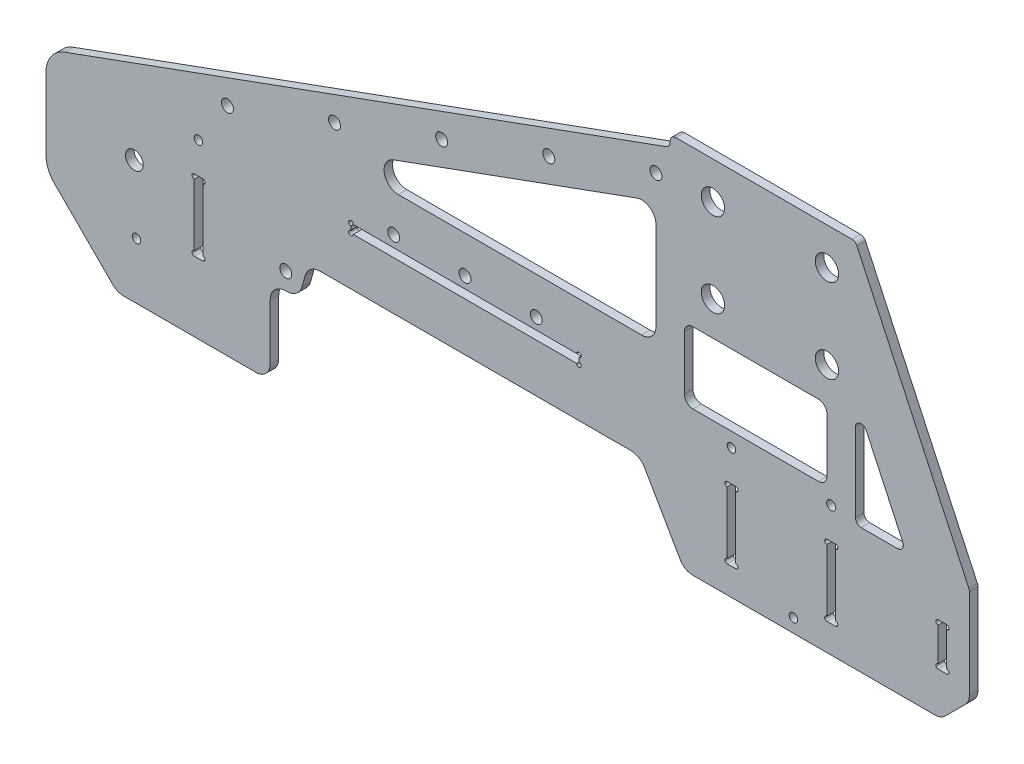
from build123d import *

# Parameters (mm, degrees)
SKETCH1_W           = 274
SKETCH1_H           = 44
BOSS_EXTRUDE1_DEPTH = 3
SKETCH2_W           = 3
SKETCH2_H           = 25
CUT_EXTRUDE1_DEPTH  = 144.923590839
SKETCH3_W           = 274
SKETCH3_H           = 6
BOSS_EXTRUDE2_DEPTH = 3
SKETCH4_W           = 80
SKETCH4_H           = 3
CUT_EXTRUDE2_DEPTH  = 146.869804963
SKETCH6_R           = 2.1
CUT_EXTRUDE3_DEPTH  = 146.869804963
CUT_EXTRUDE4_DEPTH  = 146.869804963
SKETCH8_R           = 1.5
CUT_EXTRUDE5_DEPTH  = 3
BOSS_EXTRUDE4_DEPTH = 3
BOSS_EXTRUDE5_DEPTH = 3
FILLET2_R           = 5
BOSS_EXTRUDE6_DEPTH = 3
FILLET3_R           = 2
SKETCH13_W          = 3
SKETCH13_H          = 15
CUT_EXTRUDE6_DEPTH  = 3
CHAMFER2_SIZE       = 10
FILLET4_R           = 2
FILLET5_R           = 5
CUT_EXTRUDE9_DEPTH  = 220.631509579
FILLET6_R           = 5.5
BOSS_EXTRUDE7_DEPTH = 3
FILLET7_R           = 10
SKETCH18_R          = 4.1
CUT_EXTRUDE10_DEPTH = 220.631509579
SKETCH19_R          = 1.6
SKETCH19_W          = 3
SKETCH19_H          = 25
CUT_EXTRUDE11_DEPTH = 220.631509579
SKETCH20_R          = 3.1
CUT_EXTRUDE12_DEPTH = 220.631509579
SKETCH21_R          = 0.8
CUT_EXTRUDE13_DEPTH = 220.631509579
SKETCH22_R          = 2.1
CUT_EXTRUDE14_DEPTH = 220.631509579
SKETCH23_W          = 50
SKETCH23_H          = 25
CUT_EXTRUDE15_DEPTH = 220.631509579
FILLET8_R           = 3
SKETCH25_R          = 2.1
CUT_EXTRUDE16_DEPTH = 220.631509579


with BuildPart() as part:
    # Sketch1 → Boss-Extrude1 (new body)
    with BuildSketch(Plane.XY):
        with Locations((0, 22)):
            Rectangle(SKETCH1_W, SKETCH1_H)
    extrude(amount=BOSS_EXTRUDE1_DEPTH)

    # Sketch2 → Cut-Extrude1 (cut, through all)
    with BuildSketch(Plane.XY.offset(3)):
        with Locations((-93.5, 22)):
            Rectangle(SKETCH2_W, SKETCH2_H)
        with Locations((93.5, 22)):
            Rectangle(SKETCH2_W, SKETCH2_H)
    extrude(amount=-CUT_EXTRUDE1_DEPTH, mode=Mode.SUBTRACT)

    # Sketch3 → Boss-Extrude2 (add)
    with BuildSketch(Plane.XY.offset(3)):
        with Locations((0, 47)):
            Rectangle(SKETCH3_W, SKETCH3_H)
    extrude(amount=-BOSS_EXTRUDE2_DEPTH)

    # Sketch4 → Cut-Extrude2 (cut, through all)
    with BuildSketch(Plane.XY.offset(3)):
        with Locations((0, 45.5)):
            Rectangle(SKETCH4_W, SKETCH4_H)
    extrude(amount=-CUT_EXTRUDE2_DEPTH, mode=Mode.SUBTRACT)

    # Sketch6 → Cut-Extrude3 (cut, through all)
    with BuildSketch(Plane(origin=(0, 0, 0), x_dir=(-1, 0, 0), z_dir=(0, 0, -1))):
        with Locations((62.874847501, 21)):
            Circle(SKETCH6_R)
    extrude(amount=-CUT_EXTRUDE3_DEPTH, mode=Mode.SUBTRACT)

    # Sketch7 → Cut-Extrude4 (cut, through all)
    with BuildSketch(Plane(origin=(0, 0, 0), x_dir=(-1, 0, 0), z_dir=(0, 0, -1))):
        Polygon((0, 15), (-68.339745962, 15), (-77, 0), (0, 0), align=None)
        Polygon((68.339745962, 15), (0, 15), (0, 0), (77, 0), align=None)
    extrude(amount=-CUT_EXTRUDE4_DEPTH, mode=Mode.SUBTRACT)

    # Sketch8 → Cut-Extrude5 (cut)
    with BuildSketch(Plane(origin=(0, 0, 0), x_dir=(-1, 0, 0), z_dir=(0, 0, -1))):
        with Locations((-93.5, 45.5)):
            Circle(SKETCH8_R)
        with Locations((-115.25, 4.75)):
            Circle(SKETCH8_R)
        with Locations((-71.75, 4.75)):
            Circle(SKETCH8_R)
        with Locations((71.75, 4.75)):
            Circle(SKETCH8_R)
        with Locations(Location((115.25, 4.75, 0), (0, 0, 180))):
            Circle(SKETCH8_R)
        with Locations(Location((93.5, 45.5, 0), (0, 0, 180))):
            Circle(SKETCH8_R)
    extrude(amount=-CUT_EXTRUDE5_DEPTH, mode=Mode.SUBTRACT)

    # Sketch9 → Boss-Extrude4 (add)
    with BuildSketch(Plane(origin=(0, 0, 0), x_dir=(-1, 0, 0), z_dir=(0, 0, -1))):
        Polygon((137, 0), (122, -15), (68.339745962, -15), (68.339745962, 15), (77, 0), align=None)
    extrude(amount=-BOSS_EXTRUDE4_DEPTH)

    # Sketch10 → Boss-Extrude5 (add)
    with BuildSketch(Plane.XY.offset(3)):
        Polygon((137, 50), (137, 130), (72, 130), (72, 126.069778962), (-137, 50), align=None)
        Polygon((-51.754445725, 64), (67, 107.223083431), (67, 64), align=None, mode=Mode.SUBTRACT)
    extrude(amount=-BOSS_EXTRUDE5_DEPTH)

    # Fillet2
    fillet2_edges = [part.edges().sort_by_distance(p)[0] for p in [
        (67, 64, 1.5),
        (67, 107.223083431, 1.5),
        (-51.754445725, 64, 1.5),
    ]]
    fillet(fillet2_edges, radius=FILLET2_R)

    # Sketch11 → Boss-Extrude6 (add)
    with BuildSketch(Plane.XY.offset(3)):
        Polygon((137, 44), (154.942501021, 44), (137, 82.576377194), (137, 130), (177, 44), (177, 0), (137, 0), align=None)
    extrude(amount=-BOSS_EXTRUDE6_DEPTH)

    # Fillet3
    fillet3_edges = [part.edges().sort_by_distance(p)[0] for p in [
        (137, 44, 1.5),
        (154.942501021, 44, 1.5),
        (137, 82.576377194, 1.5),
    ]]
    fillet(fillet3_edges, radius=FILLET3_R)

    # Sketch13 → Cut-Extrude6 (cut)
    with BuildSketch(Plane.XY.offset(3)):
        with Locations((167.5, 22)):
            Rectangle(SKETCH13_W, SKETCH13_H)
    extrude(amount=-CUT_EXTRUDE6_DEPTH, mode=Mode.SUBTRACT)

    # Chamfer2
    chamfer2_edges = [part.edges().sort_by_distance(p)[0] for p in [
        (177, 0, 1.5),
    ]]
    chamfer(chamfer2_edges, length=CHAMFER2_SIZE)

    # Fillet4
    fillet4_edges = [part.edges().sort_by_distance(p)[0] for p in [
        (137, 130, 1.5),
        (72, 130, 1.5),
        (72, 126.069778962, 1.5),
        (177, 44, 1.5),
    ]]
    fillet(fillet4_edges, radius=FILLET4_R)

    # Fillet5
    fillet5_edges = [part.edges().sort_by_distance(p)[0] for p in [
        (-68.339745962, -15, 1.5),
        (-122, -15, 1.5),
        (167, 0, 1.5),
        (177, 10, 1.5),
        (77, 0, 1.5),
    ]]
    fillet(fillet5_edges, radius=FILLET5_R)

    # Sketch15 → Cut-Extrude9 (cut, through all)
    with BuildSketch(Plane(origin=(0, 0, 0), x_dir=(-1, 0, 0), z_dir=(0, 0, -1))):
        Polygon((-68.339745962, 15), (-61.411542732, 27), (54.936767243, 27), (58.339745962, 15), align=None)
    extrude(amount=-CUT_EXTRUDE9_DEPTH, mode=Mode.SUBTRACT)

    # Fillet6
    fillet6_edges = [part.edges().sort_by_distance(p)[0] for p in [
        (-58.339745962, 15, 1.5),
        (61.411542732, 27, 1.5),
        (-54.936767243, 27, 1.5),
        (-68.339745962, 15, 1.5),
    ]]
    fillet(fillet6_edges, radius=FILLET6_R)

    # Sketch17 → Boss-Extrude7 (add)
    with BuildSketch(Plane(origin=(0, 0, 0), x_dir=(-1, 0, 0), z_dir=(0, 0, -1))):
        Polygon((137, 50), (147, 46.360297657), (147, 10), (137, 0), align=None)
    extrude(amount=-BOSS_EXTRUDE7_DEPTH)

    # Fillet7
    fillet7_edges = [part.edges().sort_by_distance(p)[0] for p in [
        (-147, 10, 1.5),
        (-147, 46.360297657, 1.5),
    ]]
    fillet(fillet7_edges, radius=FILLET7_R)

    # Sketch18 → Cut-Extrude10 (cut, through all)
    with BuildSketch(Plane.XY.offset(3)):
        with Locations((87, 117)):
            Circle(SKETCH18_R)
        with Locations((127, 117)):
            Circle(SKETCH18_R)
        with Locations((87, 87.509284164)):
            Circle(SKETCH18_R)
        with Locations((127, 87.509284164)):
            Circle(SKETCH18_R)
    extrude(amount=-CUT_EXTRUDE10_DEPTH, mode=Mode.SUBTRACT)

    # Sketch19 → Cut-Extrude11 (cut, through all)
    with BuildSketch(Plane.XY.offset(3)):
        with Locations((128.5, 45.5)):
            Circle(SKETCH19_R)
        with Locations((128.5, 22)):
            Rectangle(SKETCH19_W, SKETCH19_H)
    extrude(amount=-CUT_EXTRUDE11_DEPTH, mode=Mode.SUBTRACT)

    # Sketch20 → Cut-Extrude12 (cut, through all)
    with BuildSketch(Plane(origin=(0, 0, 0), x_dir=(-1, 0, 0), z_dir=(0, 0, -1))):
        with Locations((116, 28.180148829)):
            Circle(SKETCH20_R)
    extrude(amount=-CUT_EXTRUDE12_DEPTH, mode=Mode.SUBTRACT)

    # Sketch21 → Cut-Extrude13 (cut, through all)
    with BuildSketch(Plane(origin=(0, 0, 0), x_dir=(-1, 0, 0), z_dir=(0, 0, -1))):
        with Locations((-166, 28.7)):
            Circle(SKETCH21_R)
        with Locations((-169, 15.3)):
            Circle(SKETCH21_R)
        with Locations((-166, 15.3)):
            Circle(SKETCH21_R)
        with Locations((-130, 33.7)):
            Circle(SKETCH21_R)
        with Locations((-127, 33.7)):
            Circle(SKETCH21_R)
        with Locations((-130, 10.3)):
            Circle(SKETCH21_R)
        with Locations((-127, 10.3)):
            Circle(SKETCH21_R)
        with Locations((-95, 33.7)):
            Circle(SKETCH21_R)
        with Locations((-92, 33.7)):
            Circle(SKETCH21_R)
        with Locations((-95, 10.3)):
            Circle(SKETCH21_R)
        with Locations((-92, 10.3)):
            Circle(SKETCH21_R)
        with Locations((-40, 47)):
            Circle(SKETCH21_R)
        with Locations((-40, 44)):
            Circle(SKETCH21_R)
        with Locations((40, 47)):
            Circle(SKETCH21_R)
        with Locations((40, 44)):
            Circle(SKETCH21_R)
        with Locations((95, 33.7)):
            Circle(SKETCH21_R)
        with Locations((95, 10.3)):
            Circle(SKETCH21_R)
        with Locations((-169, 28.7)):
            Circle(SKETCH21_R)
        with Locations((92, 33.7)):
            Circle(SKETCH21_R)
        with Locations((92, 10.3)):
            Circle(SKETCH21_R)
    extrude(amount=-CUT_EXTRUDE13_DEPTH, mode=Mode.SUBTRACT)

    # Sketch22 → Cut-Extrude14 (cut, through all)
    with BuildSketch(Plane(origin=(0, 0, 0), x_dir=(-1, 0, 0), z_dir=(0, 0, -1))):
        with Locations((0, 51)):
            Circle(SKETCH22_R)
        with Locations((-25, 51)):
            Circle(SKETCH22_R)
        with Locations(Location((25, 51, 0), (0, 0, 180))):
            Circle(SKETCH22_R)
    extrude(amount=-CUT_EXTRUDE14_DEPTH, mode=Mode.SUBTRACT)

    # Sketch23 → Cut-Extrude15 (cut, through all)
    with BuildSketch(Plane(origin=(0, 0, 0), x_dir=(-1, 0, 0), z_dir=(0, 0, -1))):
        with Locations((-102, 63.034014914)):
            Rectangle(SKETCH23_W, SKETCH23_H)
    extrude(amount=-CUT_EXTRUDE15_DEPTH, mode=Mode.SUBTRACT)

    # Fillet8
    fillet8_edges = [part.edges().sort_by_distance(p)[0] for p in [
        (77, 75.534014914, 1.5),
        (77, 50.534014914, 1.5),
        (127, 50.534014914, 1.5),
        (127, 75.534014914, 1.5),
    ]]
    fillet(fillet8_edges, radius=FILLET8_R)

    # Sketch25 → Cut-Extrude16 (cut, through all)
    with BuildSketch(Plane(origin=(0, 0, 0), x_dir=(-1, 0, 0), z_dir=(0, 0, -1))):
        with Locations((-67, 115.73650561)):
            Circle(SKETCH25_R)
        with Locations((-29.412295169, 102.055699877)):
            Circle(SKETCH25_R)
        with Locations((8.175409663, 88.374894144)):
            Circle(SKETCH25_R)
        with Locations((45.763114494, 74.694088411)):
            Circle(SKETCH25_R)
        with Locations((83.350819326, 61.013282678)):
            Circle(SKETCH25_R)
    extrude(amount=-CUT_EXTRUDE16_DEPTH, mode=Mode.SUBTRACT)


solid = part.part
